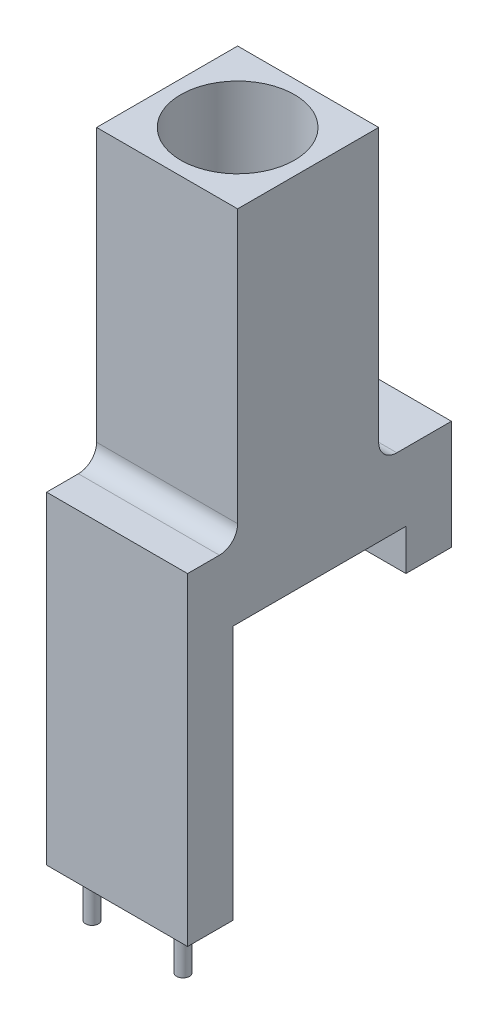
from build123d import *

# Parameters (mm, degrees)
BOSS_EXTRUDE1_DEPTH = 31
SKETCH3_R           = 12.5
CUT_EXTRUDE1_DEPTH  = 87.208303263
SKETCH4_W           = 31
SKETCH4_H           = 15
BOSS_EXTRUDE2_DEPTH = 11
SKETCH5_W           = 31
SKETCH5_H           = 10
BOSS_EXTRUDE3_DEPTH = 56
SKETCH6_R           = 1.4
BOSS_EXTRUDE4_DEPTH = 10
SKETCH7_W           = 31
SKETCH7_H           = 15
BOSS_EXTRUDE5_DEPTH = 16
SKETCH8_W           = 31
SKETCH8_H           = 10
BOSS_EXTRUDE6_DEPTH = 9
FILLET1_R           = 4


with BuildPart() as part:
    # Sketch1 → Boss-Extrude1 (new body)
    with BuildSketch(Plane.XY):
        with BuildLine():
            Line((-15.5, 107.5), (-15.5, 28.565713714))
            ThreePointArc((-15.5, 28.565713714), (0, 32.5), (15.5, 28.565713714))
            Line((15.5, 28.565713714), (15.5, 107.5))
            Line((15.5, 107.5), (-15.5, 107.5))
        make_face()
    extrude(amount=BOSS_EXTRUDE1_DEPTH)

    # Sketch3 → Cut-Extrude1 (cut, through all)
    with BuildSketch(Plane(origin=(0, 107.5, 0), x_dir=(1, 0, 0), z_dir=(0, 1, 0))):
        with Locations(Location((0, -15.5, 0), (0, 0, 270))):
            Circle(SKETCH3_R)
    extrude(amount=-CUT_EXTRUDE1_DEPTH, mode=Mode.SUBTRACT)

    # Sketch4 → Boss-Extrude2 (add)
    with BuildSketch(Plane.XY.offset(31)):
        with Locations((0, 36.065713714)):
            Rectangle(SKETCH4_W, SKETCH4_H)
    extrude(amount=BOSS_EXTRUDE2_DEPTH)

    # Sketch5 → Boss-Extrude3 (add)
    with BuildSketch(Plane.XZ.offset(-28.565713714)):
        with Locations((0, 37)):
            Rectangle(SKETCH5_W, SKETCH5_H)
    extrude(amount=BOSS_EXTRUDE3_DEPTH)

    # Sketch6 → Boss-Extrude4 (add)
    with BuildSketch(Plane.XZ.offset(27.434286286)):
        with Locations(Location((-10, 37.5, 0), (0, 0, 270))):
            Circle(SKETCH6_R)
        with Locations(Location((10, 37.5, 0), (0, 0, 270))):
            Circle(SKETCH6_R)
    extrude(amount=BOSS_EXTRUDE4_DEPTH)

    # Sketch7 → Boss-Extrude5 (add)
    with BuildSketch(Plane(origin=(0, 0, 0), x_dir=(-1, 0, 0), z_dir=(0, 0, -1))):
        with Locations((0, 36.065713714)):
            Rectangle(SKETCH7_W, SKETCH7_H)
    extrude(amount=BOSS_EXTRUDE5_DEPTH)

    # Sketch8 → Boss-Extrude6 (add)
    with BuildSketch(Plane.XZ.offset(-28.565713714)):
        with Locations((0, -11)):
            Rectangle(SKETCH8_W, SKETCH8_H)
    extrude(amount=BOSS_EXTRUDE6_DEPTH)

    # Fillet1
    fillet1_edges = [part.edges().sort_by_distance(p)[0] for p in [
        (0, 43.565713714, 31),
        (0, 43.565713714, 0),
    ]]
    fillet(fillet1_edges, radius=FILLET1_R)


solid = part.part
